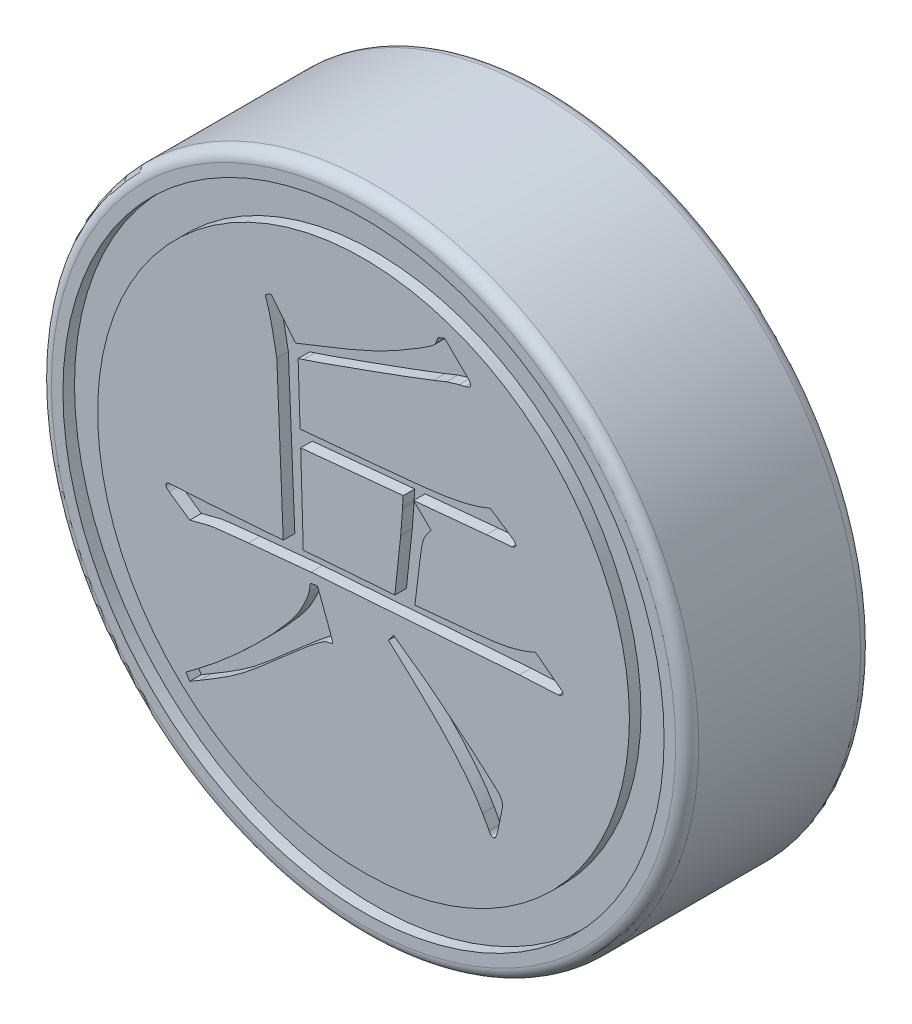
from build123d import *

# Parameters (mm, degrees)
SKETCH_1_R          = 14
EXTRUDE_1_DEPTH     = 8
SKETCH_2_R          = 13
SKETCH_2_R_2        = 11.5
CUT_EXTRUDE_1_DEPTH = 0.5
SKETCH_3_R          = 5.1
CUT_EXTRUDE_2_DEPTH = 5
CHAMFER_1_SIZE      = 0.5
FILLET_1_R          = 0.5
CUT_EXTRUDE_3_DEPTH = 0.5


with BuildPart() as part:
    # 草图1 → 凸台-拉伸1 (new body)
    with BuildSketch(Plane.XY):
        Circle(SKETCH_1_R)
    extrude(amount=EXTRUDE_1_DEPTH)

    # 草图2 → 切除-拉伸1 (cut)
    with BuildSketch(Plane.XY.offset(8)):
        Circle(SKETCH_2_R)
        Circle(SKETCH_2_R_2, mode=Mode.SUBTRACT)
    extrude(amount=-CUT_EXTRUDE_1_DEPTH, mode=Mode.SUBTRACT)

    # 草图3 → 切除-拉伸2 (cut)
    with BuildSketch(Plane(origin=(0, 0, 0), x_dir=(-1, 0, 0), z_dir=(0, 0, -1))):
        Circle(SKETCH_3_R)
    extrude(amount=-CUT_EXTRUDE_2_DEPTH, mode=Mode.SUBTRACT)

    # 倒角1
    chamfer_1_edges = [part.edges().sort_by_distance(p)[0] for p in [
        (5.1, 0, 0),
    ]]
    chamfer(chamfer_1_edges, length=CHAMFER_1_SIZE)

    # 圆角1
    fillet_1_edges = [part.edges().sort_by_distance(p)[0] for p in [
        (-14, 0, 0),
        (-14, 0, 8),
    ]]
    fillet(fillet_1_edges, radius=FILLET_1_R)

    # 草图4 → 切除-拉伸3 (cut)
    # profile 1 of 3: a face of its own
    with BuildSketch(Plane.XY.offset(8)):
        with BuildLine():
            Line((-3.470295364, -0.789475356), (-3.750073757, 5.886424921))
            add(Edge.make_bspline(
                [(-3.750073757, 5.886424921), (-3.756589665, 5.924273365), (-3.771527293, 6.011040394), (-3.795739763, 6.160165334), (-3.832567973, 6.34361707), (-3.87489039, 6.55120917), (-3.916321012, 6.759183376), (-3.955467739, 6.942664239), (-3.985287853, 7.090737729), (-4.013723916, 7.21730741), (-4.047501418, 7.353439964), (-4.098499102, 7.527700753), (-4.168246368, 7.755625512), (-4.221760398, 7.925252121), (-4.251458798, 8.01938891)],
                knots=[0, 0, 0, 0, 0.630289147, 1.444929086, 2.479157629, 3.700600644, 4.92204366, 5.959265314, 6.779523526, 7.400822496, 8.08810284, 9.080983889, 10.380048945, 12, 12, 12, 12], degree=3))
            Line((-4.251458798, 8.01938891), (-3.999381236, 8.168973398))
            add(Edge.make_bspline(
                [(-3.999381236, 8.168973398), (-3.832758534, 7.959884578), (-3.482516702, 7.520378734), (-3.125572401, 7.086297295), (-2.938439408, 6.85872409)],
                knots=[0, 0, 0, 0, 0.951472307, 2, 2, 2, 2], degree=3))
            Line((-2.938439408, 6.85872409), (-2.606029436, 6.988917996))
            add(Edge.make_bspline(
                [(-2.606029436, 6.988917996), (-2.465517285, 7.042987239), (-2.192341652, 7.148105549), (-1.797643189, 7.307756429), (-1.424967331, 7.452707063), (-1.078802042, 7.595601366), (-0.755963673, 7.727137704), (-0.457446025, 7.852135509), (-0.185208301, 7.971909945), (0.151544984, 8.115857514), (0.56007096, 8.304687371), (1.048473717, 8.554705125), (1.549195157, 8.827052894), (1.96541779, 9.069055194), (2.287628372, 9.261347687), (2.497834075, 9.395397654), (2.6778395, 9.51052698), (2.825764215, 9.610785149), (2.943633756, 9.69546454), (3.027571157, 9.768175449), (3.088640233, 9.819647646), (3.107385792, 9.856443947), (3.114192171, 9.869804423)],
                knots=[0, 0, 0, 0, 1.403395919, 2.728401553, 3.968704697, 5.130708529, 6.219204549, 7.218307286, 8.147326807, 8.991578586, 10.632125291, 12.34123428, 14.105269298, 15.944754933, 16.828953581, 17.602644603, 18.268743989, 18.820209629, 19.269518642, 19.617764706, 19.861213076, 20, 20, 20, 20], degree=3))
            Line((3.114192171, 9.869804423), (3.224995495, 10.149582816))
            Line((3.224995495, 10.149582816), (3.504773888, 10.263156223))
            Line((3.504773888, 10.263156223), (4.535244803, 9.252075891))
            add(Edge.make_bspline(
                [(4.535244803, 9.252075891), (4.553408973, 9.231321015), (4.58577418, 9.19433965), (4.622009761, 9.137396609), (4.639035934, 9.082870678), (4.629654241, 9.031134111), (4.598977129, 8.98704212), (4.548283989, 8.951764968), (4.481023573, 8.91714136), (4.426764409, 8.904500144), (4.396740647, 8.897505254)],
                knots=[0, 0, 0, 0, 1.258974768, 2.243261142, 3.072377866, 3.80087887, 4.561666957, 5.464806301, 6.597176082, 8, 8, 8, 8], degree=3))
            Line((4.396740647, 8.897505254), (4.144663085, 8.842103592))
            add(Edge.make_bspline(
                [(4.144663085, 8.842103592), (4.047313153, 8.816629829), (3.859528862, 8.767491917), (3.676176421, 8.703801136), (3.587876382, 8.673128522)],
                knots=[0, 0, 0, 0, 1.036827225, 2, 2, 2, 2], degree=3))
            Line((3.587876382, 8.673128522), (3.031089678, 8.448751791))
            add(Edge.make_bspline(
                [(3.031089678, 8.448751791), (2.983113356, 8.429264646), (2.867142805, 8.382159431), (2.661167136, 8.301968163), (2.393020862, 8.198887558), (2.059930151, 8.079470039), (1.667357455, 7.929892847), (1.208744766, 7.76605156), (0.690065715, 7.573556113), (0.129281127, 7.371234593), (-0.429188215, 7.172051855), (-0.939751602, 6.985588941), (-1.384165227, 6.827514688), (-1.760332829, 6.695605427), (-2.066836367, 6.585605462), (-2.307278889, 6.507306428), (-2.4774233, 6.445911038), (-2.570840152, 6.419804663), (-2.606029436, 6.409970628)],
                knots=[0, 0, 0, 0, 0.414597664, 1.002184374, 1.769697154, 2.714604855, 3.835139742, 5.133119945, 6.613645086, 8.264703102, 9.906299581, 11.360922912, 12.616611386, 13.682834746, 14.552627827, 15.22359467, 15.707535137, 16, 16, 16, 16], degree=3))
            Line((-2.606029436, 6.409970628), (-2.827636084, 6.335178384))
            Line((-2.827636084, 6.335178384), (-2.744533591, 3.736840434))
            Line((-2.744533591, 3.736840434), (0.546325135, 4.036009409))
            Line((0.546325135, 4.036009409), (2.612807129, 4.240995558))
            add(Edge.make_bspline(
                [(2.612807129, 4.240995558), (2.756002932, 4.256020312), (3.036347993, 4.285435388), (3.44587469, 4.339866017), (3.834558202, 4.407091638), (4.203159362, 4.481753402), (4.553046995, 4.563565269), (4.882349304, 4.658953532), (5.193376884, 4.758723532), (5.389804374, 4.839035813), (5.485383307, 4.878114672)],
                knots=[0, 0, 0, 0, 1.170139494, 2.290869009, 3.356794789, 4.375223574, 5.347195318, 6.275939888, 7.161095901, 8, 8, 8, 8], degree=3))
            Line((5.485383307, 4.878114672), (6.48815339, 4.204984478))
            add(Edge.make_bspline(
                [(6.48815339, 4.204984478), (6.511561352, 4.177407649), (6.552376804, 4.129323124), (6.587001326, 4.061532654), (6.58595695, 4.005961081), (6.549970366, 3.972571986), (6.500805877, 3.936676329), (6.457374884, 3.916981478), (6.432751728, 3.905815503)],
                knots=[0, 0, 0, 0, 1.596994161, 2.784609663, 3.27512252, 3.911421618, 4.815882638, 6, 6, 6, 6], degree=3))
            Line((6.432751728, 3.905815503), (5.316408238, 3.811632678))
            Line((5.316408238, 3.811632678), (2.164053667, 3.512463703))
            Line((2.164053667, 3.512463703), (2.917516271, 2.783931847))
            add(Edge.make_bspline(
                [(2.917516271, 2.783931847), (2.87215138, 2.720350783), (2.780246018, 2.591541024), (2.661492088, 2.420261682), (2.577647854, 2.237059933), (2.532677202, 2.028795303), (2.481081771, 1.756772971), (2.457119829, 1.551501799), (2.44383206, 1.437671459)],
                knots=[0, 0, 0, 0, 0.966745104, 1.95854233, 2.572117436, 3.444867058, 4.583085734, 6, 6, 6, 6], degree=3))
            Line((2.44383206, 1.437671459), (2.222225412, -0.376732973))
            Line((2.222225412, -0.376732973), (4.759621534, -0.13296566))
            add(Edge.make_bspline(
                [(4.759621534, -0.13296566), (4.889869569, -0.12058284), (5.142343407, -0.096579882), (5.507292603, -0.052910481), (5.84586151, -0.00152267), (6.165856197, 0.048776562), (6.476810846, 0.119776478), (6.790770003, 0.212723563), (7.114760362, 0.324237266), (7.329008265, 0.417699201), (7.438291894, 0.46537229)],
                knots=[0, 0, 0, 0, 1.137933525, 2.205779496, 3.196163312, 4.116400641, 5.022334264, 5.967738974, 6.963383744, 8, 8, 8, 8], degree=3))
            Line((7.438291894, 0.46537229), (8.52416447, -0.357342392))
            add(Edge.make_bspline(
                [(8.52416447, -0.357342392), (8.548529585, -0.379783793), (8.591344821, -0.419218612), (8.628232587, -0.483513598), (8.620624549, -0.538860053), (8.580207131, -0.573488343), (8.520897981, -0.609663075), (8.470255392, -0.628837553), (8.441061977, -0.639890868)],
                knots=[0, 0, 0, 0, 1.427987249, 2.509309389, 2.990942725, 3.691361615, 4.669162889, 6, 6, 6, 6], degree=3))
            Line((8.441061977, -0.639890868), (6.740230952, -0.731303611))
            Line((6.740230952, -0.731303611), (-2.27084938, -1.387813306))
            Line((-2.27084938, -1.387813306), (-4.977220571, -1.648201117))
            add(Edge.make_bspline(
                [(-4.977220571, -1.648201117), (-5.093533882, -1.660493271), (-5.312271881, -1.683609809), (-5.621102168, -1.711884956), (-5.888452858, -1.744413267), (-6.116821749, -1.767690247), (-6.303920631, -1.791721654), (-6.451385743, -1.805344376), (-6.557080587, -1.823677958), (-6.655617392, -1.838774694), (-6.78082532, -1.869761164), (-6.9679908, -1.916793307), (-7.220867467, -1.9794276), (-7.409499639, -2.031773342), (-7.514616693, -2.0609435)],
                knots=[0, 0, 0, 0, 1.634169375, 3.073207516, 4.332636422, 5.396880572, 6.28020656, 6.968333153, 7.464648912, 7.778546558, 8.360671347, 9.264946481, 10.475865668, 12, 12, 12, 12], degree=3))
            Line((-7.514616693, -2.0609435), (-8.406583452, -1.443214968))
            add(Edge.make_bspline(
                [(-8.406583452, -1.443214968), (-8.445034091, -1.414420273), (-8.51197182, -1.364292329), (-8.555395011, -1.266180417), (-8.540651782, -1.197960465), (-8.505630672, -1.157810865), (-8.448453389, -1.133961375), (-8.404038003, -1.128020259), (-8.378882621, -1.124655411)],
                knots=[0, 0, 0, 0, 1.792647658, 3.120774224, 3.726771359, 4.31767906, 5.047189961, 6, 6, 6, 6], degree=3))
            Line((-8.378882621, -1.124655411), (-6.705752427, -1.030472586))
            Line((-6.705752427, -1.030472586), (-3.470295364, -0.789475356))
        make_face()
        with BuildLine():
            Line((1.355189401, -0.432134635), (1.607266963, 1.922436002))
            add(Edge.make_bspline(
                [(1.607266963, 1.922436002), (1.614977849, 2.033287435), (1.629313856, 2.239381391), (1.657784088, 2.524197831), (1.671305395, 2.762886152), (1.684494027, 2.905841816), (1.690369456, 2.969527414)],
                knots=[0, 0, 0, 0, 1.26938157, 2.36002243, 3.269403191, 4, 4, 4, 4], degree=3))
            Line((1.690369456, 2.969527414), (1.690369456, 3.06371024))
            Line((1.690369456, 3.06371024), (1.718070287, 3.473682539))
            Line((1.718070287, 3.473682539), (-2.71683276, 3.044319658))
            Line((-2.71683276, 3.044319658), (-2.606029436, -0.731303611))
            Line((-2.606029436, -0.731303611), (1.355189401, -0.432134635))
        make_face(mode=Mode.SUBTRACT)
    # profile 2 of 3: a face of its own
    with BuildSketch(Plane.XY.offset(8)):
        with BuildLine():
            Line((-7.680821679, -7.836566768), (-7.2348383, -7.501386713))
            add(Edge.make_bspline(
                [(-7.2348383, -7.501386713), (-6.994115228, -7.316829786), (-6.50894376, -6.944859809), (-5.804707291, -6.346601318), (-5.10737577, -5.719252109), (-4.548433837, -5.169330149), (-4.118146782, -4.733400599), (-3.826068102, -4.425136796), (-3.566924681, -4.138468642), (-3.338536032, -3.874538117), (-3.141178304, -3.63386903), (-2.974807619, -3.414980646), (-2.836837017, -3.219873218), (-2.707256359, -2.994890093), (-2.58351314, -2.755326539), (-2.470365045, -2.511024292), (-2.389092753, -2.325175785), (-2.363968372, -2.215479963), (-2.353951873, -2.171746824)],
                knots=[0, 0, 0, 0, 1.990133681, 4.011065803, 6.061573232, 8.143934525, 9.15508157, 10.080861917, 10.93024791, 11.690623573, 12.37101567, 12.972080522, 13.49477336, 13.937454482, 14.674564943, 15.262788477, 15.706091138, 16, 16, 16, 16], degree=3))
            Line((-2.353951873, -2.171746824), (-2.298550211, -1.817176187))
            Line((-2.298550211, -1.817176187), (-1.991070987, -1.761774525))
            Line((-1.991070987, -1.761774525), (-1.461985114, -3.163436574))
            add(Edge.make_bspline(
                [(-1.461985114, -3.163436574), (-1.44184224, -3.221196002), (-1.407094559, -3.320834519), (-1.361035723, -3.452020993), (-1.344192973, -3.528099433), (-1.325678925, -3.585744966), (-1.366252689, -3.602001127), (-1.411165537, -3.622778159), (-1.490800129, -3.639802934), (-1.579669995, -3.653499411), (-1.678325664, -3.693273612), (-1.787196616, -3.762398204), (-1.932136665, -3.860139364), (-2.110011008, -3.996024426), (-2.322879582, -4.163339132), (-2.566609264, -4.371798287), (-2.848211166, -4.609743879), (-3.151690914, -4.878177301), (-3.462180486, -5.15028251), (-3.758618114, -5.412752534), (-4.036355701, -5.650004082), (-4.291157746, -5.868888373), (-4.523882538, -6.069380167), (-4.736188176, -6.247500176), (-4.924734785, -6.407423248), (-5.100582585, -6.5482746), (-5.275745526, -6.683526261), (-5.466010118, -6.822972905), (-5.677454897, -6.972210731), (-5.914811322, -7.12642904), (-6.171124078, -7.29230145), (-6.449224394, -7.468097516), (-6.750834043, -7.650028758), (-6.960468865, -7.773077695), (-7.068633314, -7.836566768)],
                knots=[0, 0, 0, 0, 0.776659852, 1.339785379, 1.701147831, 1.852897925, 1.96269721, 2.176672123, 2.512585275, 2.964550665, 3.314680241, 3.841644837, 4.587339593, 5.518435666, 6.661756624, 7.99995419, 9.560278214, 11.308796939, 13.106590115, 14.76423697, 16.299310587, 17.710668044, 18.99831029, 20.171107941, 21.203809027, 22.114458354, 23.010713897, 23.993064381, 25.087659297, 26.272350994, 27.560466551, 28.936050712, 30.419106211, 32, 32, 32, 32], degree=3))
            Line((-7.068633314, -7.836566768), (-7.514616693, -8.099724663))
            Line((-7.514616693, -8.099724663), (-7.680821679, -7.836566768))
        make_face()
    # profile 3 of 3: a face of its own
    with BuildSketch(Plane.XY.offset(8)):
        with BuildLine():
            Line((1.299787739, -1.966760674), (2.806712947, -3.049863167))
            Line((2.806712947, -3.049863167), (4.704219872, -4.584489206))
            Line((4.704219872, -4.584489206), (5.706989955, -5.46260555))
            add(Edge.make_bspline(
                [(5.706989955, -5.46260555), (5.741787367, -5.495213332), (5.806707025, -5.556047917), (5.888189242, -5.650298541), (5.94758161, -5.739885549), (6.000805571, -5.850165739), (6.025716389, -5.999998582), (6.000084247, -6.114851048), (5.986768348, -6.174516907)],
                knots=[0, 0, 0, 0, 1.052523292, 1.963636077, 2.744008513, 3.418984598, 4.659162448, 6, 6, 6, 6], degree=3))
            Line((5.986768348, -6.174516907), (5.792862531, -7.108034912))
            add(Edge.make_bspline(
                [(5.792862531, -7.108034912), (5.782925788, -7.147188906), (5.765251172, -7.21683263), (5.727317576, -7.304729352), (5.683604725, -7.36658589), (5.626480565, -7.396197072), (5.568615852, -7.387835446), (5.514547709, -7.357260634), (5.468492748, -7.297738872), (5.443772487, -7.248870702), (5.429981645, -7.22160832)],
                knots=[0, 0, 0, 0, 1.564229591, 2.782315704, 3.699513984, 4.45238824, 5.136548343, 5.873933244, 6.813918243, 8, 8, 8, 8], degree=3))
            Line((5.429981645, -7.22160832), (5.150203251, -6.714683112))
            add(Edge.make_bspline(
                [(5.150203251, -6.714683112), (5.11202425, -6.646004753), (5.032513745, -6.502977151), (4.896629452, -6.287544864), (4.739941874, -6.063803473), (4.569439689, -5.827505887), (4.376426872, -5.584853061), (4.17006468, -5.328916851), (3.941030073, -5.067144139), (3.698693193, -4.790781667), (3.431852503, -4.511552472), (3.151706682, -4.217407275), (2.84930008, -3.917686997), (2.531627846, -3.604683426), (2.19615078, -3.281619322), (1.837898402, -2.953970251), (1.464368299, -2.612773908), (1.20854338, -2.383011238), (1.078181091, -2.265929649)],
                knots=[0, 0, 0, 0, 0.622780861, 1.29698575, 2.017735785, 2.787787988, 3.606267519, 4.475040005, 5.393568145, 6.363056642, 7.388272879, 8.454623569, 9.582879097, 10.762934864, 11.989797528, 13.274360598, 14.61107903, 16, 16, 16, 16], degree=3))
            Line((1.078181091, -2.265929649), (1.299787739, -1.966760674))
        make_face()
    extrude(amount=-CUT_EXTRUDE_3_DEPTH, mode=Mode.SUBTRACT)


solid = part.part
